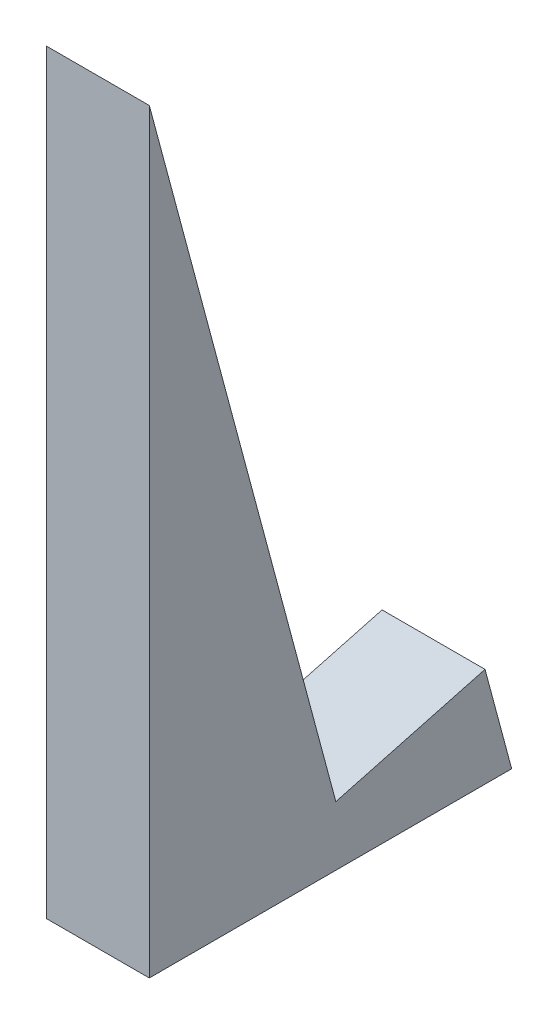
from build123d import *

# Parameters (mm, degrees)
BOSS_EXTRU_1_DEPTH = 10


with BuildPart() as part:
    # Esquisse1 → Boss.-Extru.1 (new body)
    with BuildSketch(Plane(origin=(0, 0, 0), x_dir=(0, 0, -1), z_dir=(1, 0, 0))):
        Polygon((0, 0), (35.194411003, 0), (32.606220552, 9.659258263), (18.117333157, 5.776972586), (0, 73.391780427), align=None)
    extrude(amount=BOSS_EXTRU_1_DEPTH)


solid = part.part
